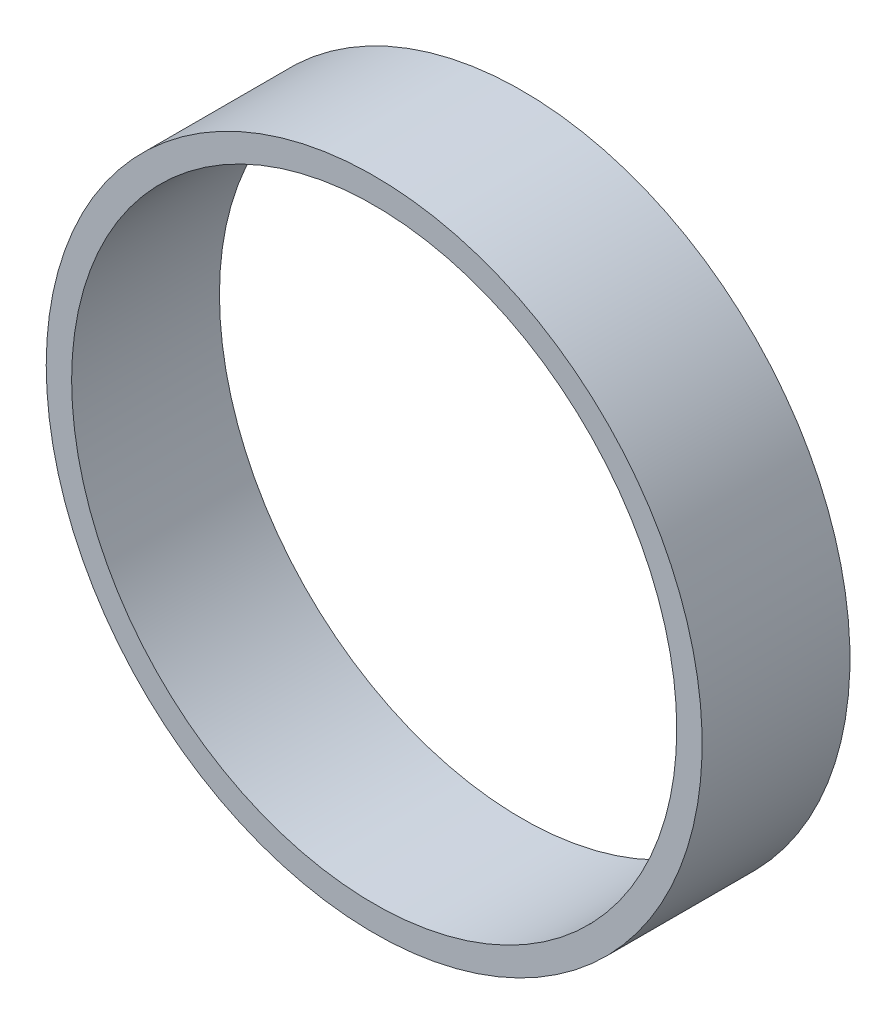
from build123d import *

# Parameters (mm, degrees)
SKETCH1_W = 5.5
SKETCH1_H = 32


with BuildPart() as part:
    # Sketch1 → Revolve2 (revolve)
    with BuildSketch(Plane(origin=(0, 0, 0), x_dir=(1, 0, 0), z_dir=(0, 1, 0))):
        with Locations((-68.25, 0)):
            Rectangle(SKETCH1_W, SKETCH1_H)
    revolve(axis=Axis((0, 0, -72.619565217), (0, 0, 1)))


solid = part.part
